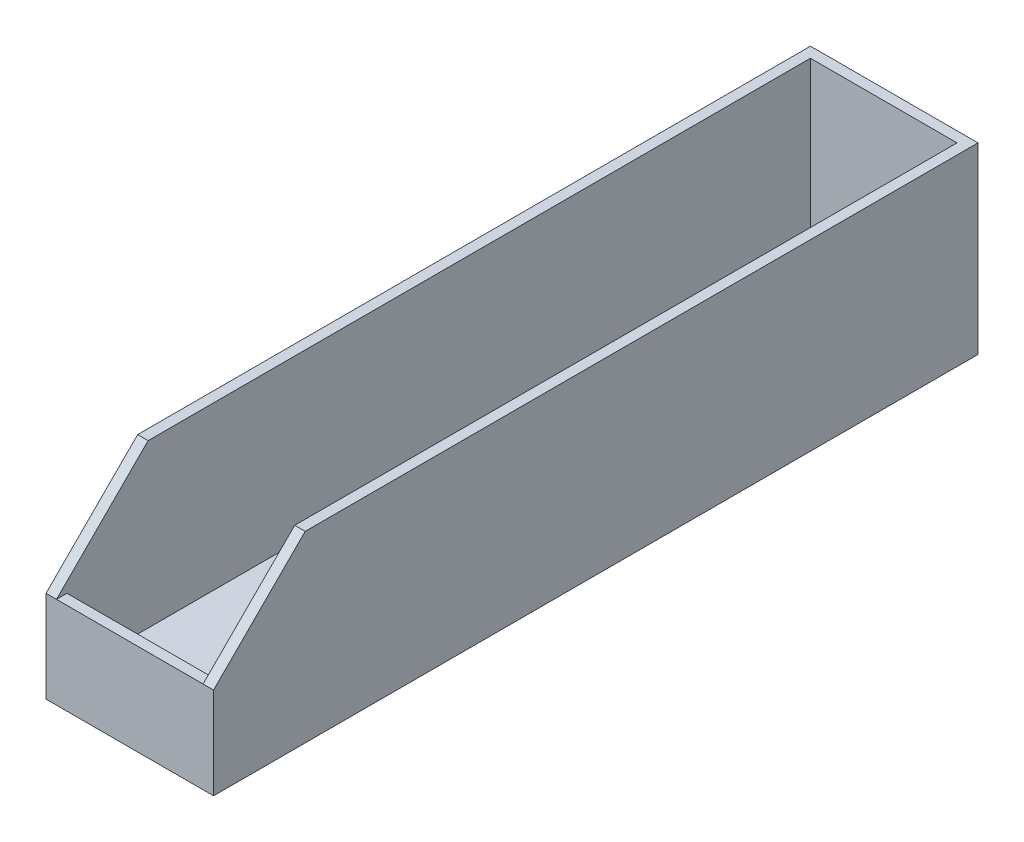
from build123d import *

# Parameters (mm, degrees)
SKETCH1_W           = 28
SKETCH1_H           = 142
BOSS_EXTRUDE1_DEPTH = 4
BOSS_EXTRUDE2_DEPTH = 35
SKETCH1_5_W         = 28
SKETCH1_5_H         = 2
BOSS_EXTRUDE3_DEPTH = 17.5
CUT_EXTRUDE1_REACH  = 82.907
SKETCH2_R           = 1.7
SKETCH2_3_R         = 3.05
SKETCH2_3_R_2       = 1.7
CUT_EXTRUDE2_DEPTH  = 2
CUT_EXTRUDE3_DEPTH  = 88.051708771


with BuildPart() as part:
    # Sketch1 → Boss-Extrude1 (new body)
    with BuildSketch(Plane(origin=(0, 0, 0), x_dir=(1, 0, 0), z_dir=(0, 1, 0))):
        Rectangle(SKETCH1_W, SKETCH1_H)
    extrude(amount=BOSS_EXTRUDE1_DEPTH)

    # Sketch1<4> → Boss-Extrude2 (add)
    with BuildSketch(Plane(origin=(0, 0, 0), x_dir=(1, 0, 0), z_dir=(0, 1, 0))):
        Polygon((-14, -73), (-14, -71), (-14, 71), (14, 71), (14, -71), (14, -73), (16, -73), (16, 73), (-16, 73), (-16, -73), align=None)
    extrude(amount=BOSS_EXTRUDE2_DEPTH)

    # Sketch1<5> → Boss-Extrude3 (add)
    with BuildSketch(Plane(origin=(0, 0, 0), x_dir=(1, 0, 0), z_dir=(0, 1, 0))):
        with Locations((0, -72)):
            Rectangle(SKETCH1_5_W, SKETCH1_5_H)
    extrude(amount=BOSS_EXTRUDE3_DEPTH)

    # Sketch2 → Cut-Extrude1 (cut, up to next)
    with BuildSketch(Plane(origin=(0, 4, 0), x_dir=(1, 0, 0), z_dir=(0, 1, 0)), mode=Mode.PRIVATE) as cut_extrude1_sk1:
        with Locations((0, 30)):
            Circle(SKETCH2_R)
    cut_extrude1_tool1 = extrude(cut_extrude1_sk1.sketch, amount=-CUT_EXTRUDE1_REACH, mode=Mode.PRIVATE) & part.part
    # Sketch2 → Cut-Extrude1 (cut, up to next)
    with BuildSketch(Plane(origin=(0, 4, 0), x_dir=(1, 0, 0), z_dir=(0, 1, 0)), mode=Mode.PRIVATE) as cut_extrude1_sk2:
        with Locations((0, -30)):
            Circle(SKETCH2_R)
    cut_extrude1_tool2 = extrude(cut_extrude1_sk2.sketch, amount=-CUT_EXTRUDE1_REACH, mode=Mode.PRIVATE) & part.part
    add(cut_extrude1_tool1.solids().sort_by_distance((0, 4, -30))[0], mode=Mode.SUBTRACT)
    add(cut_extrude1_tool2.solids().sort_by_distance((0, 4, 30))[0], mode=Mode.SUBTRACT)

    # Sketch2<3> → Cut-Extrude2 (cut)
    # profile 1 of 2: a face of its own
    with BuildSketch(Plane(origin=(0, 4, 0), x_dir=(1, 0, 0), z_dir=(0, 1, 0))):
        with Locations((0, 30)):
            Circle(SKETCH2_3_R)
        with Locations((0, 30)):
            Circle(SKETCH2_3_R_2, mode=Mode.SUBTRACT)
    # profile 2 of 2: a face of its own
    with BuildSketch(Plane(origin=(0, 4, 0), x_dir=(1, 0, 0), z_dir=(0, 1, 0))):
        with Locations((0, -30)):
            Circle(SKETCH2_3_R)
        with Locations((0, -30)):
            Circle(SKETCH2_3_R_2, mode=Mode.SUBTRACT)
    extrude(amount=-CUT_EXTRUDE2_DEPTH, mode=Mode.SUBTRACT)

    # Sketch3 → Cut-Extrude3 (cut, through all)
    with BuildSketch(Plane(origin=(16, 0, 0), x_dir=(0, 0, -1), z_dir=(1, 0, 0))):
        Polygon((-73, 17.5), (-55.5, 35), (-73, 35), align=None)
    extrude(amount=-CUT_EXTRUDE3_DEPTH, mode=Mode.SUBTRACT)


solid = part.part
